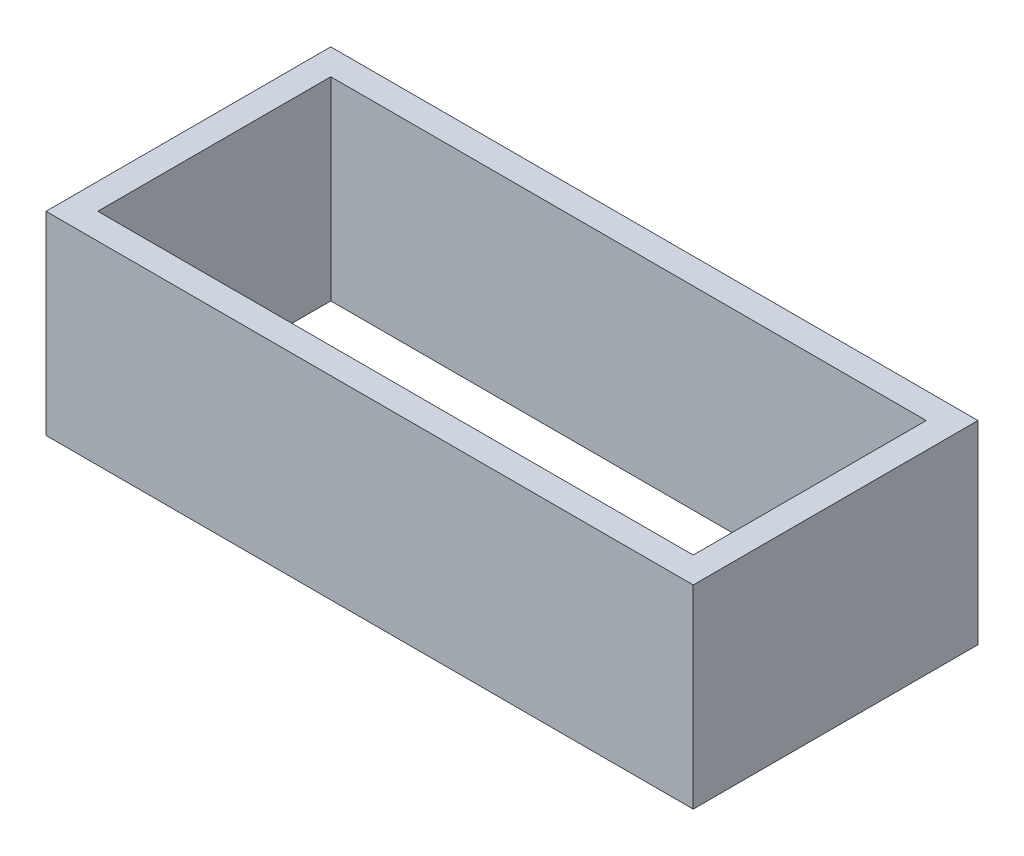
from build123d import *

# Parameters (mm, degrees)
SKETCH2_W           = 100
SKETCH2_H           = 44
SKETCH2_W_2         = 92
SKETCH2_H_2         = 36
BOSS_EXTRUDE2_DEPTH = 30


with BuildPart() as part:
    # Sketch2 → Boss-Extrude2 (new body)
    with BuildSketch(Plane(origin=(0, 0, 0), x_dir=(1, 0, 0), z_dir=(0, 1, 0))):
        Rectangle(SKETCH2_W, SKETCH2_H)
        Rectangle(SKETCH2_W_2, SKETCH2_H_2, mode=Mode.SUBTRACT)
    extrude(amount=BOSS_EXTRUDE2_DEPTH)


solid = part.part
